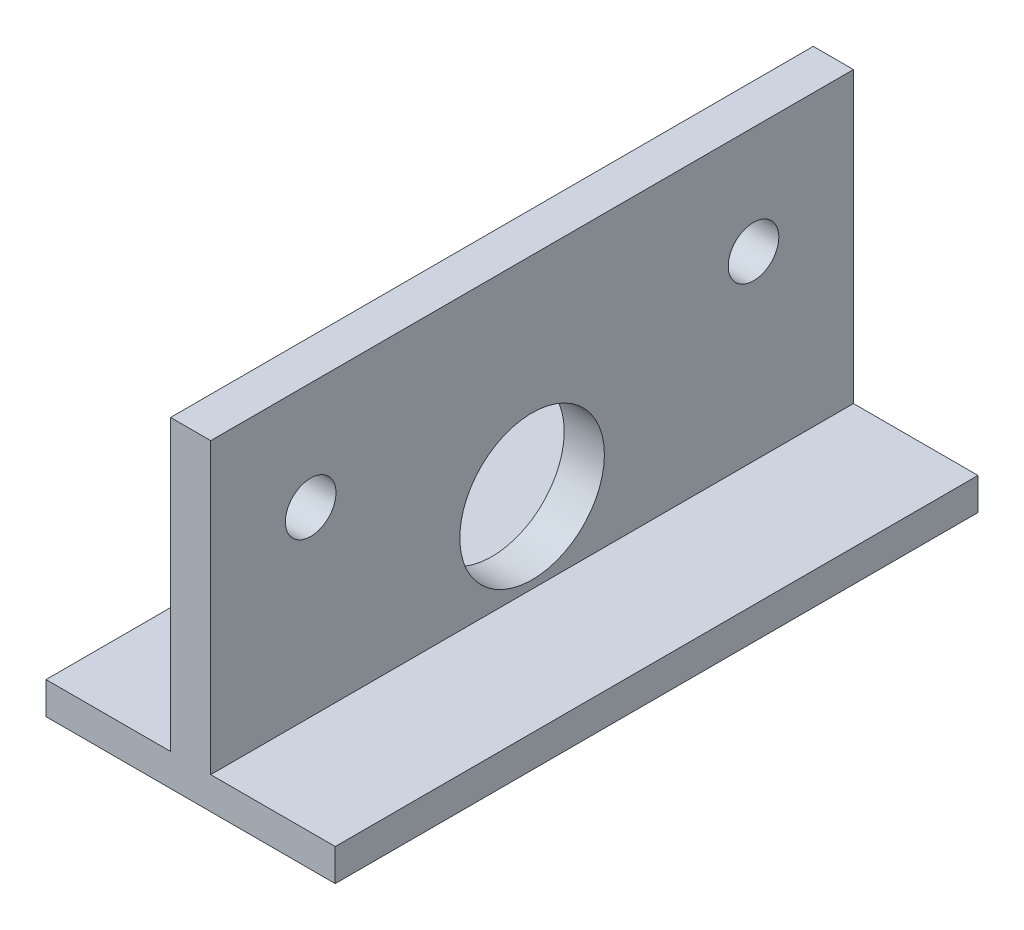
from build123d import *

# Parameters (mm, degrees)
SKETCH3_W           = 50.8
SKETCH3_H           = 25.4
SKETCH3_R           = 2.00025
SKETCH3_R_2         = 5.715
BOSS_EXTRUDE1_DEPTH = 1.5875
SKETCH4_W           = 50.8
SKETCH4_H           = 2.54
BOSS_EXTRUDE2_DEPTH = 11.43


with BuildPart() as part:
    # Sketch3 → Boss-Extrude1 (new, symmetric)
    with BuildSketch(Plane(origin=(0, 0, 0), x_dir=(0, 0, -1), z_dir=(1, 0, 0))):
        Rectangle(SKETCH3_W, SKETCH3_H)
        with Locations((-17.5006, 4.191)):
            Circle(SKETCH3_R, mode=Mode.SUBTRACT)
        with Locations((17.5006, 4.191)):
            Circle(SKETCH3_R, mode=Mode.SUBTRACT)
        with Locations((0, -3.81)):
            Circle(SKETCH3_R_2, mode=Mode.SUBTRACT)
    extrude(amount=BOSS_EXTRUDE1_DEPTH, both=True)

    # Sketch4 → Boss-Extrude2 (add, symmetric)
    with BuildSketch(Plane(origin=(0, 0, 0), x_dir=(0, 0, -1), z_dir=(1, 0, 0))):
        with Locations((0, -11.43)):
            Rectangle(SKETCH4_W, SKETCH4_H)
    extrude(amount=BOSS_EXTRUDE2_DEPTH, both=True)


solid = part.part
